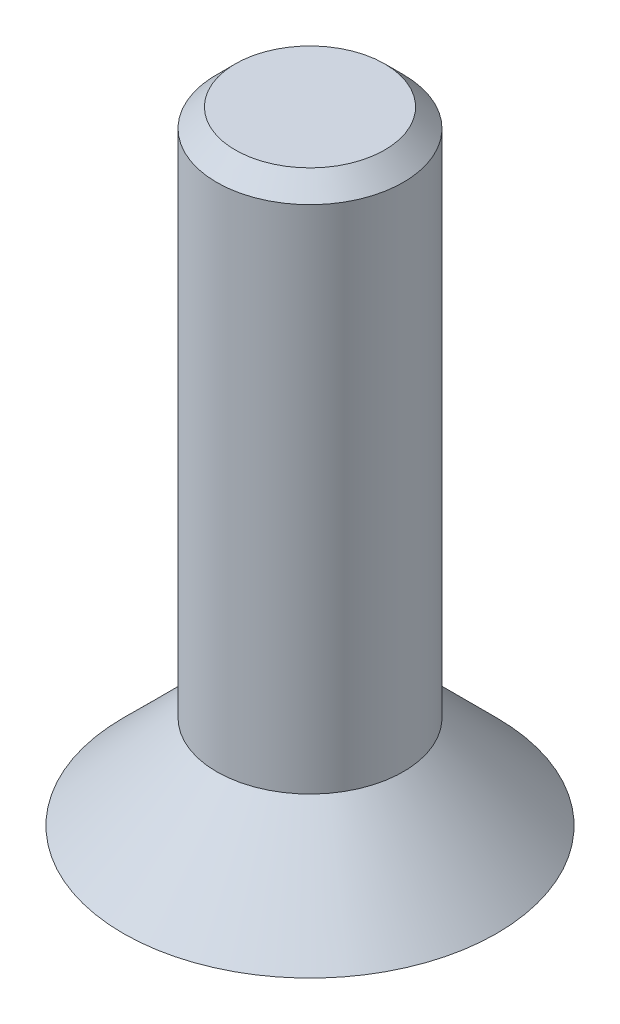
from build123d import *

# Parameters (mm, degrees)
CUT_EXTRUDE_316_DEPTH = 1.1


with BuildPart() as part:
    # Sketch 184 → Revolve 217 (revolve)
    with BuildSketch(Plane.XY, mode=Mode.PRIVATE) as revolve_217_sk:
        Polygon((0, 0), (3, 0), (1.5, 1.5), (1.5, 9.7), (1.2, 10), (0, 10), align=None)
    revolve(revolve_217_sk.sketch.rotate(Axis((0, -2, 0), (0, 1, 0)), 90), axis=Axis((0, -2, 0), (0, 1, 0)))

    # Sketch 268 → Cut-Extrude 316 (cut)
    with BuildSketch(Plane.XZ):
        Polygon((1.154700538, 0), (0.577350269, 1), (-0.577350269, 1), (-1.154700538, 0), (-0.577350269, -1), (0.577350269, -1), align=None)
    extrude(amount=-CUT_EXTRUDE_316_DEPTH, mode=Mode.SUBTRACT)


solid = part.part
